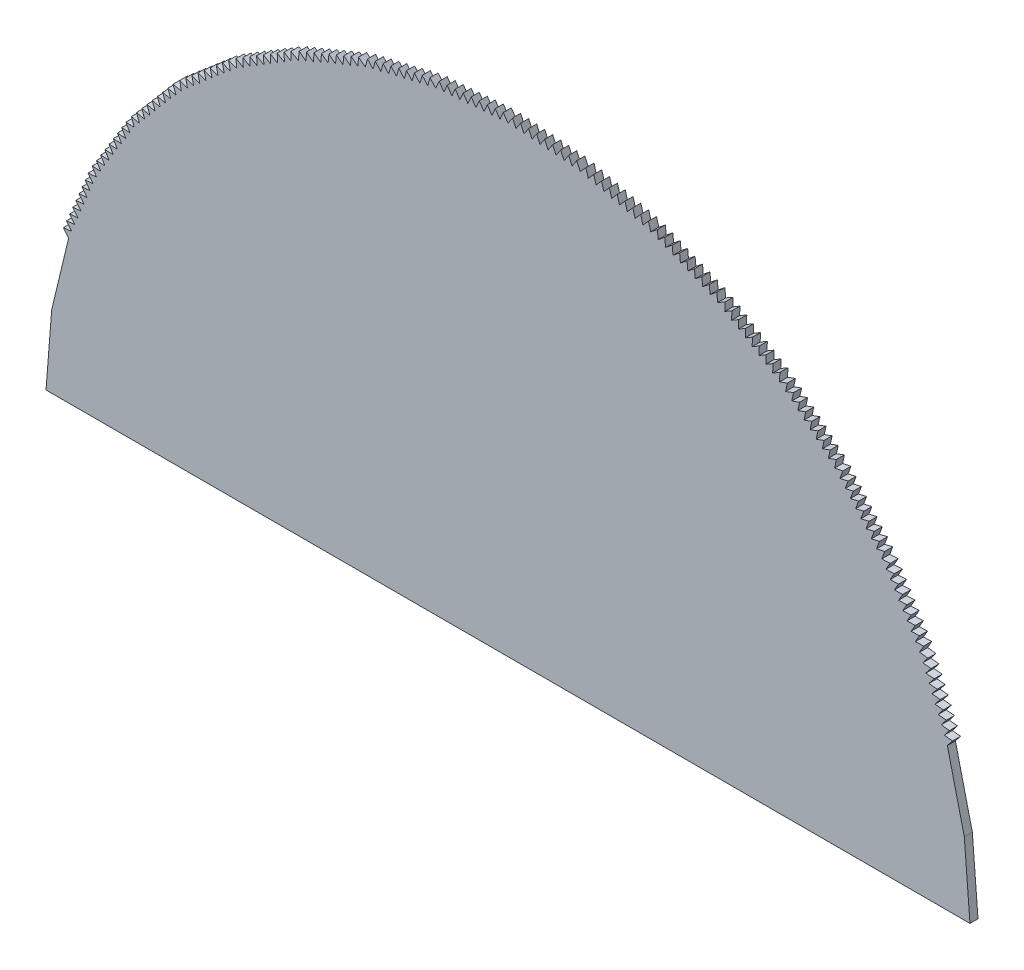
from build123d import *

# Parameters (mm, degrees)
BOSS_EXTRUDE1_DEPTH = 3


with BuildPart() as part:
    # Sketch1 → Boss-Extrude1 (new body)
    with BuildSketch(Plane.XY):
        Polygon((-172.5, 0), (172.5, 0), (170.376238753, 26.984945219), (164.057249061, 53.30543153), (166.002991747, 55.771937117), (162.909198764, 56.077070127), (164.85494145, 58.543575715), (161.761148467, 58.848708725), (163.706891153, 61.315214312), (160.61309817, 61.620347322), (162.558840856, 64.08685291), (159.465047873, 64.39198592), (161.410790559, 66.858491507), (158.316997575, 67.163624517), (160.262740262, 69.630130105), (157.168947278, 69.935263115), (159.114689965, 72.401768702), (156.020896981, 72.706901712), (157.966639668, 75.1734073), (154.872846684, 75.47854031), (156.818589371, 77.945045898), (153.698625423, 78.313361205), (155.234520876, 81.053955367), (152.095397083, 80.929592076), (153.667025182, 83.61187586), (150.527901389, 83.487512569), (152.099529488, 86.169796353), (148.960405695, 86.045433062), (150.532033793, 88.727716846), (147.39291, 88.603353555), (148.964538099, 91.285637339), (145.825414306, 91.161274048), (147.397042405, 93.843557832), (144.257918612, 93.719194541), (145.829546711, 96.401478325), (142.690422918, 96.277115034), (144.262051017, 98.959398819), (141.122927224, 98.835035527), (142.694555323, 101.517319312), (139.55543153, 101.392956021), (140.643750648, 104.340009789), (137.607087385, 103.674173917), (138.695406503, 106.621227686), (135.65874324, 105.955391814), (136.747062358, 108.902445582), (133.710399095, 108.236609711), (134.798718213, 111.183663479), (131.76205495, 110.517827608), (132.850374068, 113.464881376), (129.813710805, 112.799045504), (130.902029923, 115.746099273), (127.86536666, 115.080263401), (128.953685778, 118.02731717), (125.917022515, 117.361481298), (127.005341633, 120.308535066), (123.96867837, 119.642699195), (125.056997488, 122.589752963), (121.975919755, 121.975919755), (122.589752963, 125.056997488), (119.642699195, 123.96867837), (120.308535066, 127.005341633), (117.361481298, 125.917022515), (118.02731717, 128.953685778), (115.080263401, 127.86536666), (115.746099273, 130.902029923), (112.799045504, 129.813710805), (113.464881376, 132.850374068), (110.517827608, 131.76205495), (111.183663479, 134.798718213), (108.236609711, 133.710399095), (108.902445582, 136.747062358), (105.955391814, 135.65874324), (106.621227686, 138.695406503), (103.674173917, 137.607087385), (104.340009789, 140.643750648), (101.39295602, 139.55543153), (101.517319312, 142.694555323), (98.835035527, 141.122927224), (98.959398818, 144.262051017), (96.277115034, 142.690422918), (96.401478325, 145.829546711), (93.719194541, 144.257918612), (93.843557832, 147.397042405), (91.161274048, 145.825414306), (91.285637339, 148.964538099), (88.603353555, 147.39291), (88.727716846, 150.532033793), (86.045433062, 148.960405695), (86.169796353, 152.099529487), (83.487512569, 150.527901389), (83.61187586, 153.667025182), (80.929592076, 152.095397083), (81.053955367, 155.234520876), (78.313361205, 153.698625423), (77.945045898, 156.818589371), (75.47854031, 154.872846684), (75.1734073, 157.966639668), (72.706901712, 156.020896981), (72.401768702, 159.114689965), (69.935263115, 157.168947278), (69.630130105, 160.262740262), (67.163624517, 158.316997576), (66.858491507, 161.410790559), (64.39198592, 159.465047873), (64.08685291, 162.558840856), (61.620347322, 160.61309817), (61.315214312, 163.706891153), (58.848708725, 161.761148467), (58.543575715, 164.85494145), (56.077070127, 162.909198764), (55.771937117, 166.002991748), (53.30543153, 164.057249061), (52.453665449, 167.08116357), (50.388321769, 164.757585153), (49.536555687, 167.781499662), (47.471212007, 165.457921244), (46.619445926, 168.481835753), (44.554102246, 166.158257336), (43.702336165, 169.182171845), (41.636992485, 166.858593427), (40.785226404, 169.882507936), (38.719882724, 167.558929519), (37.868116643, 170.582844028), (35.802772963, 168.25926561), (34.951006881, 171.283180119), (32.885663201, 168.959601702), (32.03389712, 171.983516211), (29.96855344, 169.659937794), (29.116787359, 172.683852303), (26.984945219, 170.376238753), (25.670534664, 173.229685107), (23.92601601, 170.616981703), (22.679782663, 173.465062394), (20.935264008, 170.85235899), (19.689030662, 173.700439681), (17.944512007, 171.087736277), (16.698278661, 173.935816968), (14.953760006, 171.323113564), (13.707526659, 174.171194256), (11.963008005, 171.558490851), (10.716774658, 174.406571543), (8.972256004, 171.793868138), (7.726022657, 174.64194883), (5.981504002, 172.029245426), (4.735270656, 174.877326117), (2.990752001, 172.264622713), (1.744518655, 175.112703404), (0, 172.5), (-1.744518655, 175.112703404), (-2.990752001, 172.264622713), (-4.735270656, 174.877326117), (-5.981504002, 172.029245426), (-7.726022657, 174.64194883), (-8.972256004, 171.793868138), (-10.716774658, 174.406571543), (-11.963008005, 171.558490851), (-13.707526659, 174.171194256), (-14.953760006, 171.323113564), (-16.698278661, 173.935816968), (-17.944512007, 171.087736277), (-19.689030662, 173.700439681), (-20.935264008, 170.85235899), (-22.679782663, 173.465062394), (-23.92601601, 170.616981703), (-25.670534664, 173.229685107), (-26.984945219, 170.376238753), (-29.116787359, 172.683852303), (-29.96855344, 169.659937794), (-32.03389712, 171.983516211), (-32.885663201, 168.959601702), (-34.951006881, 171.283180119), (-35.802772963, 168.25926561), (-37.868116643, 170.582844028), (-38.719882724, 167.558929519), (-40.785226404, 169.882507936), (-41.636992485, 166.858593427), (-43.702336165, 169.182171845), (-44.554102246, 166.158257336), (-46.619445926, 168.481835753), (-47.471212007, 165.457921244), (-49.536555687, 167.781499662), (-50.388321769, 164.757585153), (-52.453665449, 167.08116357), (-53.30543153, 164.057249061), (-55.771937117, 166.002991748), (-56.077070127, 162.909198764), (-58.543575715, 164.85494145), (-58.848708725, 161.761148467), (-61.315214312, 163.706891153), (-61.620347322, 160.61309817), (-64.08685291, 162.558840856), (-64.39198592, 159.465047873), (-66.858491507, 161.410790559), (-67.163624517, 158.316997576), (-69.630130105, 160.262740262), (-69.935263115, 157.168947278), (-72.401768702, 159.114689965), (-72.706901712, 156.020896981), (-75.1734073, 157.966639668), (-75.47854031, 154.872846684), (-77.945045898, 156.818589371), (-78.313361205, 153.698625423), (-81.053955367, 155.234520876), (-80.929592076, 152.095397083), (-83.61187586, 153.667025182), (-83.487512569, 150.527901389), (-86.169796353, 152.099529487), (-86.045433062, 148.960405695), (-88.727716846, 150.532033793), (-88.603353555, 147.39291), (-91.285637339, 148.964538099), (-91.161274048, 145.825414306), (-93.843557832, 147.397042405), (-93.719194541, 144.257918612), (-96.401478325, 145.829546711), (-96.277115034, 142.690422918), (-98.959398818, 144.262051017), (-98.835035527, 141.122927224), (-101.517319312, 142.694555323), (-101.39295602, 139.55543153), (-104.340009789, 140.643750648), (-103.674173917, 137.607087385), (-106.621227686, 138.695406503), (-105.955391814, 135.65874324), (-108.902445582, 136.747062358), (-108.236609711, 133.710399095), (-111.183663479, 134.798718213), (-110.517827608, 131.76205495), (-113.464881376, 132.850374068), (-112.799045504, 129.813710805), (-115.746099273, 130.902029923), (-115.080263401, 127.86536666), (-118.02731717, 128.953685778), (-117.361481298, 125.917022515), (-120.308535066, 127.005341633), (-119.642699195, 123.96867837), (-122.589752963, 125.056997488), (-121.975919755, 121.975919755), (-125.056997488, 122.589752963), (-123.96867837, 119.642699195), (-127.005341633, 120.308535066), (-125.917022515, 117.361481298), (-128.953685778, 118.02731717), (-127.86536666, 115.080263401), (-130.902029923, 115.746099273), (-129.813710805, 112.799045504), (-132.850374068, 113.464881376), (-131.76205495, 110.517827608), (-134.798718213, 111.183663479), (-133.710399095, 108.236609711), (-136.747062358, 108.902445582), (-135.65874324, 105.955391814), (-138.695406503, 106.621227686), (-137.607087385, 103.674173917), (-140.643750648, 104.340009789), (-139.55543153, 101.392956021), (-142.694555323, 101.517319312), (-141.122927224, 98.835035527), (-144.262051017, 98.959398819), (-142.690422918, 96.277115034), (-145.829546711, 96.401478325), (-144.257918612, 93.719194541), (-147.397042405, 93.843557832), (-145.825414306, 91.161274048), (-148.964538099, 91.285637339), (-147.39291, 88.603353555), (-150.532033793, 88.727716846), (-148.960405695, 86.045433062), (-152.099529488, 86.169796353), (-150.527901389, 83.487512569), (-153.667025182, 83.61187586), (-152.095397083, 80.929592076), (-155.234520876, 81.053955367), (-153.698625423, 78.313361205), (-156.818589371, 77.945045898), (-154.872846684, 75.47854031), (-157.966639668, 75.1734073), (-156.020896981, 72.706901712), (-159.114689965, 72.401768702), (-157.168947278, 69.935263115), (-160.262740262, 69.630130105), (-158.316997575, 67.163624517), (-161.410790559, 66.858491507), (-159.465047873, 64.39198592), (-162.558840856, 64.08685291), (-160.61309817, 61.620347322), (-163.706891153, 61.315214312), (-161.761148467, 58.848708725), (-164.85494145, 58.543575715), (-162.909198764, 56.077070127), (-166.002991747, 55.771937117), (-164.057249061, 53.30543153), (-170.376238753, 26.984945219), align=None)
    extrude(amount=BOSS_EXTRUDE1_DEPTH)


solid = part.part
